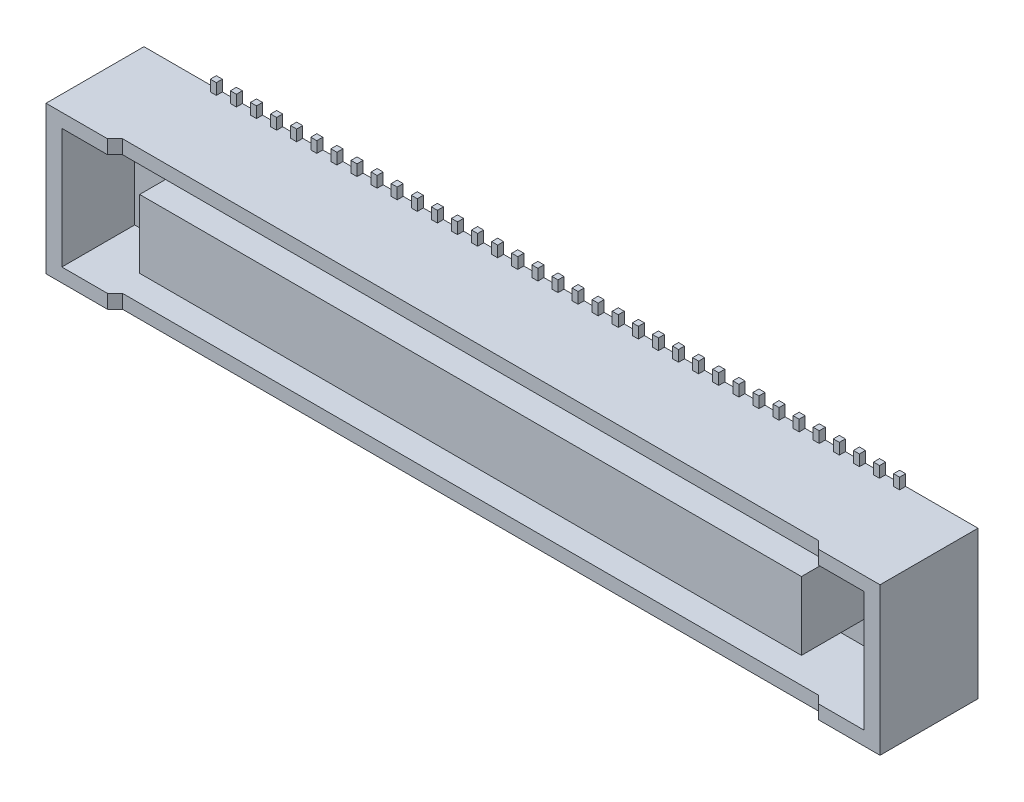
from build123d import *

# Parameters (mm, degrees)
BOSS_EXTRUDE1_DEPTH      = 1.47
CUT_EXTRUDE1_DEPTH       = 9.619216902
CUT_EXTRUDE1_DEPTH_BACK  = 1.3
SKETCH2_W                = 15.968931966
SKETCH2_H                = 2.390499192
SKETCH2_W_2              = 13.172045166
SKETCH2_H_2              = 1.359871744
SKETCH3_W                = 0.12
SKETCH3_H                = 0.12
BOSS_EXTRUDE2_DEPTH      = 0.22
LPATTERN1_COUNT          = 35
LPATTERN1_PITCH          = 0.4
MIRROR2_COPY_1_SKETCH_W  = 0.12
MIRROR2_COPY_1_SKETCH_H  = 0.12
MIRROR2_COPY_1_DEPTH     = 0.22
MIRROR2_COPY_2_SKETCH_W  = 0.12
MIRROR2_COPY_2_SKETCH_H  = 0.12
MIRROR2_COPY_2_DEPTH     = 0.22
MIRROR2_COPY_3_SKETCH_W  = 0.12
MIRROR2_COPY_3_SKETCH_H  = 0.12
MIRROR2_COPY_3_DEPTH     = 0.22
MIRROR2_COPY_4_SKETCH_W  = 0.12
MIRROR2_COPY_4_SKETCH_H  = 0.12
MIRROR2_COPY_4_DEPTH     = 0.22
MIRROR2_COPY_5_SKETCH_W  = 0.12
MIRROR2_COPY_5_SKETCH_H  = 0.12
MIRROR2_COPY_5_DEPTH     = 0.22
MIRROR2_COPY_6_SKETCH_W  = 0.12
MIRROR2_COPY_6_SKETCH_H  = 0.12
MIRROR2_COPY_6_DEPTH     = 0.22
MIRROR2_COPY_7_SKETCH_W  = 0.12
MIRROR2_COPY_7_SKETCH_H  = 0.12
MIRROR2_COPY_7_DEPTH     = 0.22
MIRROR2_COPY_8_SKETCH_W  = 0.12
MIRROR2_COPY_8_SKETCH_H  = 0.12
MIRROR2_COPY_8_DEPTH     = 0.22
MIRROR2_COPY_9_SKETCH_W  = 0.12
MIRROR2_COPY_9_SKETCH_H  = 0.12
MIRROR2_COPY_9_DEPTH     = 0.22
MIRROR2_COPY_10_SKETCH_W = 0.12
MIRROR2_COPY_10_SKETCH_H = 0.12
MIRROR2_COPY_10_DEPTH    = 0.22
MIRROR2_COPY_11_SKETCH_W = 0.12
MIRROR2_COPY_11_SKETCH_H = 0.12
MIRROR2_COPY_11_DEPTH    = 0.22
MIRROR2_COPY_12_SKETCH_W = 0.12
MIRROR2_COPY_12_SKETCH_H = 0.12
MIRROR2_COPY_12_DEPTH    = 0.22
MIRROR2_COPY_13_SKETCH_W = 0.12
MIRROR2_COPY_13_SKETCH_H = 0.12
MIRROR2_COPY_13_DEPTH    = 0.22
MIRROR2_COPY_14_SKETCH_W = 0.12
MIRROR2_COPY_14_SKETCH_H = 0.12
MIRROR2_COPY_14_DEPTH    = 0.22
MIRROR2_COPY_15_SKETCH_W = 0.12
MIRROR2_COPY_15_SKETCH_H = 0.12
MIRROR2_COPY_15_DEPTH    = 0.22
MIRROR2_COPY_16_SKETCH_W = 0.12
MIRROR2_COPY_16_SKETCH_H = 0.12
MIRROR2_COPY_16_DEPTH    = 0.22
MIRROR2_COPY_17_SKETCH_W = 0.12
MIRROR2_COPY_17_SKETCH_H = 0.12
MIRROR2_COPY_17_DEPTH    = 0.22
MIRROR2_COPY_18_SKETCH_W = 0.12
MIRROR2_COPY_18_SKETCH_H = 0.12
MIRROR2_COPY_18_DEPTH    = 0.22
MIRROR2_COPY_19_SKETCH_W = 0.12
MIRROR2_COPY_19_SKETCH_H = 0.12
MIRROR2_COPY_19_DEPTH    = 0.22
MIRROR2_COPY_20_SKETCH_W = 0.12
MIRROR2_COPY_20_SKETCH_H = 0.12
MIRROR2_COPY_20_DEPTH    = 0.22
MIRROR2_COPY_21_SKETCH_W = 0.12
MIRROR2_COPY_21_SKETCH_H = 0.12
MIRROR2_COPY_21_DEPTH    = 0.22
MIRROR2_COPY_22_SKETCH_W = 0.12
MIRROR2_COPY_22_SKETCH_H = 0.12
MIRROR2_COPY_22_DEPTH    = 0.22
MIRROR2_COPY_23_SKETCH_W = 0.12
MIRROR2_COPY_23_SKETCH_H = 0.12
MIRROR2_COPY_23_DEPTH    = 0.22
MIRROR2_COPY_24_SKETCH_W = 0.12
MIRROR2_COPY_24_SKETCH_H = 0.12
MIRROR2_COPY_24_DEPTH    = 0.22
MIRROR2_COPY_25_SKETCH_W = 0.12
MIRROR2_COPY_25_SKETCH_H = 0.12
MIRROR2_COPY_25_DEPTH    = 0.22
MIRROR2_COPY_26_SKETCH_W = 0.12
MIRROR2_COPY_26_SKETCH_H = 0.12
MIRROR2_COPY_26_DEPTH    = 0.22
MIRROR2_COPY_27_SKETCH_W = 0.12
MIRROR2_COPY_27_SKETCH_H = 0.12
MIRROR2_COPY_27_DEPTH    = 0.22
MIRROR2_COPY_28_SKETCH_W = 0.12
MIRROR2_COPY_28_SKETCH_H = 0.12
MIRROR2_COPY_28_DEPTH    = 0.22
MIRROR2_COPY_29_SKETCH_W = 0.12
MIRROR2_COPY_29_SKETCH_H = 0.12
MIRROR2_COPY_29_DEPTH    = 0.22
MIRROR2_COPY_30_SKETCH_W = 0.12
MIRROR2_COPY_30_SKETCH_H = 0.12
MIRROR2_COPY_30_DEPTH    = 0.22
MIRROR2_COPY_31_SKETCH_W = 0.12
MIRROR2_COPY_31_SKETCH_H = 0.12
MIRROR2_COPY_31_DEPTH    = 0.22
MIRROR2_COPY_32_SKETCH_W = 0.12
MIRROR2_COPY_32_SKETCH_H = 0.12
MIRROR2_COPY_32_DEPTH    = 0.22
MIRROR2_COPY_33_SKETCH_W = 0.12
MIRROR2_COPY_33_SKETCH_H = 0.12
MIRROR2_COPY_33_DEPTH    = 0.22
MIRROR2_COPY_34_SKETCH_W = 0.12
MIRROR2_COPY_34_SKETCH_H = 0.12
MIRROR2_COPY_34_DEPTH    = 0.22
MIRROR2_COPY_35_SKETCH_W = 0.12
MIRROR2_COPY_35_SKETCH_H = 0.12
MIRROR2_COPY_35_DEPTH    = 0.22


with BuildPart() as part:
    # Sketch1 → Boss-Extrude1 (new, symmetric)
    with BuildSketch(Plane(origin=(0, 0, 0), x_dir=(1, 0, 0), z_dir=(0, 1, 0))):
        Polygon((0, 0), (-8.3, 0), (-8.3, -1.95), (-7.076775671, -1.95), (-6.926775671, -1.8), (0, -1.8), align=None)
    boss_extrude1 = extrude(amount=BOSS_EXTRUDE1_DEPTH, both=True)

    # Mirror1: Boss-Extrude1 across plane
    add(boss_extrude1.mirror(Plane(origin=(0, 0, 0), x_dir=(0, 0, 1), z_dir=(1, 0, 0))))

    # Sketch2 → Cut-Extrude1 (cut, two sides: drawn at the far end of the back side and taken through both)
    with BuildSketch(Plane.XY.offset(1.8).offset(-CUT_EXTRUDE1_DEPTH_BACK)):
        Rectangle(SKETCH2_W, SKETCH2_H)
        Rectangle(SKETCH2_W_2, SKETCH2_H_2, mode=Mode.SUBTRACT)
    extrude(amount=CUT_EXTRUDE1_DEPTH + CUT_EXTRUDE1_DEPTH_BACK, mode=Mode.SUBTRACT)

    # Sketch3 → Boss-Extrude2 (add)
    with BuildSketch(Plane(origin=(0, -1.47, 0), x_dir=(-1, 0, 0), z_dir=(0, -1, 0))):
        with Locations((6.8, -0.06)):
            Rectangle(SKETCH3_W, SKETCH3_H)
    boss_extrude2 = extrude(amount=BOSS_EXTRUDE2_DEPTH)

    # LPattern1: Boss-Extrude2 ×35
    with Locations(*[(i * LPATTERN1_PITCH, 0, 0) for i in range(1, LPATTERN1_COUNT)]):
        add(boss_extrude2)

    # Mirror2 copy 1 sketch → Mirror2 copy 1 (add)
    with BuildSketch(Plane(origin=(0.4, 1.47, 0), x_dir=(-1, 0, 0), z_dir=(0, 1, 0))):
        with Locations((6.8, 0.06)):
            Rectangle(MIRROR2_COPY_1_SKETCH_W, MIRROR2_COPY_1_SKETCH_H)
    extrude(amount=MIRROR2_COPY_1_DEPTH)

    # Mirror2 copy 2 sketch → Mirror2 copy 2 (add)
    with BuildSketch(Plane(origin=(0.8, 1.47, 0), x_dir=(-1, 0, 0), z_dir=(0, 1, 0))):
        with Locations((6.8, 0.06)):
            Rectangle(MIRROR2_COPY_2_SKETCH_W, MIRROR2_COPY_2_SKETCH_H)
    extrude(amount=MIRROR2_COPY_2_DEPTH)

    # Mirror2 copy 3 sketch → Mirror2 copy 3 (add)
    with BuildSketch(Plane(origin=(1.2, 1.47, 0), x_dir=(-1, 0, 0), z_dir=(0, 1, 0))):
        with Locations((6.8, 0.06)):
            Rectangle(MIRROR2_COPY_3_SKETCH_W, MIRROR2_COPY_3_SKETCH_H)
    extrude(amount=MIRROR2_COPY_3_DEPTH)

    # Mirror2 copy 4 sketch → Mirror2 copy 4 (add)
    with BuildSketch(Plane(origin=(1.6, 1.47, 0), x_dir=(-1, 0, 0), z_dir=(0, 1, 0))):
        with Locations((6.8, 0.06)):
            Rectangle(MIRROR2_COPY_4_SKETCH_W, MIRROR2_COPY_4_SKETCH_H)
    extrude(amount=MIRROR2_COPY_4_DEPTH)

    # Mirror2 copy 5 sketch → Mirror2 copy 5 (add)
    with BuildSketch(Plane(origin=(2, 1.47, 0), x_dir=(-1, 0, 0), z_dir=(0, 1, 0))):
        with Locations((6.8, 0.06)):
            Rectangle(MIRROR2_COPY_5_SKETCH_W, MIRROR2_COPY_5_SKETCH_H)
    extrude(amount=MIRROR2_COPY_5_DEPTH)

    # Mirror2 copy 6 sketch → Mirror2 copy 6 (add)
    with BuildSketch(Plane(origin=(2.4, 1.47, 0), x_dir=(-1, 0, 0), z_dir=(0, 1, 0))):
        with Locations((6.8, 0.06)):
            Rectangle(MIRROR2_COPY_6_SKETCH_W, MIRROR2_COPY_6_SKETCH_H)
    extrude(amount=MIRROR2_COPY_6_DEPTH)

    # Mirror2 copy 7 sketch → Mirror2 copy 7 (add)
    with BuildSketch(Plane(origin=(2.8, 1.47, 0), x_dir=(-1, 0, 0), z_dir=(0, 1, 0))):
        with Locations((6.8, 0.06)):
            Rectangle(MIRROR2_COPY_7_SKETCH_W, MIRROR2_COPY_7_SKETCH_H)
    extrude(amount=MIRROR2_COPY_7_DEPTH)

    # Mirror2 copy 8 sketch → Mirror2 copy 8 (add)
    with BuildSketch(Plane(origin=(3.2, 1.47, 0), x_dir=(-1, 0, 0), z_dir=(0, 1, 0))):
        with Locations((6.8, 0.06)):
            Rectangle(MIRROR2_COPY_8_SKETCH_W, MIRROR2_COPY_8_SKETCH_H)
    extrude(amount=MIRROR2_COPY_8_DEPTH)

    # Mirror2 copy 9 sketch → Mirror2 copy 9 (add)
    with BuildSketch(Plane(origin=(3.6, 1.47, 0), x_dir=(-1, 0, 0), z_dir=(0, 1, 0))):
        with Locations((6.8, 0.06)):
            Rectangle(MIRROR2_COPY_9_SKETCH_W, MIRROR2_COPY_9_SKETCH_H)
    extrude(amount=MIRROR2_COPY_9_DEPTH)

    # Mirror2 copy 10 sketch → Mirror2 copy 10 (add)
    with BuildSketch(Plane(origin=(4, 1.47, 0), x_dir=(-1, 0, 0), z_dir=(0, 1, 0))):
        with Locations((6.8, 0.06)):
            Rectangle(MIRROR2_COPY_10_SKETCH_W, MIRROR2_COPY_10_SKETCH_H)
    extrude(amount=MIRROR2_COPY_10_DEPTH)

    # Mirror2 copy 11 sketch → Mirror2 copy 11 (add)
    with BuildSketch(Plane(origin=(4.4, 1.47, 0), x_dir=(-1, 0, 0), z_dir=(0, 1, 0))):
        with Locations((6.8, 0.06)):
            Rectangle(MIRROR2_COPY_11_SKETCH_W, MIRROR2_COPY_11_SKETCH_H)
    extrude(amount=MIRROR2_COPY_11_DEPTH)

    # Mirror2 copy 12 sketch → Mirror2 copy 12 (add)
    with BuildSketch(Plane(origin=(4.8, 1.47, 0), x_dir=(-1, 0, 0), z_dir=(0, 1, 0))):
        with Locations((6.8, 0.06)):
            Rectangle(MIRROR2_COPY_12_SKETCH_W, MIRROR2_COPY_12_SKETCH_H)
    extrude(amount=MIRROR2_COPY_12_DEPTH)

    # Mirror2 copy 13 sketch → Mirror2 copy 13 (add)
    with BuildSketch(Plane(origin=(5.2, 1.47, 0), x_dir=(-1, 0, 0), z_dir=(0, 1, 0))):
        with Locations((6.8, 0.06)):
            Rectangle(MIRROR2_COPY_13_SKETCH_W, MIRROR2_COPY_13_SKETCH_H)
    extrude(amount=MIRROR2_COPY_13_DEPTH)

    # Mirror2 copy 14 sketch → Mirror2 copy 14 (add)
    with BuildSketch(Plane(origin=(5.6, 1.47, 0), x_dir=(-1, 0, 0), z_dir=(0, 1, 0))):
        with Locations((6.8, 0.06)):
            Rectangle(MIRROR2_COPY_14_SKETCH_W, MIRROR2_COPY_14_SKETCH_H)
    extrude(amount=MIRROR2_COPY_14_DEPTH)

    # Mirror2 copy 15 sketch → Mirror2 copy 15 (add)
    with BuildSketch(Plane(origin=(6, 1.47, 0), x_dir=(-1, 0, 0), z_dir=(0, 1, 0))):
        with Locations((6.8, 0.06)):
            Rectangle(MIRROR2_COPY_15_SKETCH_W, MIRROR2_COPY_15_SKETCH_H)
    extrude(amount=MIRROR2_COPY_15_DEPTH)

    # Mirror2 copy 16 sketch → Mirror2 copy 16 (add)
    with BuildSketch(Plane(origin=(6.4, 1.47, 0), x_dir=(-1, 0, 0), z_dir=(0, 1, 0))):
        with Locations((6.8, 0.06)):
            Rectangle(MIRROR2_COPY_16_SKETCH_W, MIRROR2_COPY_16_SKETCH_H)
    extrude(amount=MIRROR2_COPY_16_DEPTH)

    # Mirror2 copy 17 sketch → Mirror2 copy 17 (add)
    with BuildSketch(Plane(origin=(6.8, 1.47, 0), x_dir=(-1, 0, 0), z_dir=(0, 1, 0))):
        with Locations((6.8, 0.06)):
            Rectangle(MIRROR2_COPY_17_SKETCH_W, MIRROR2_COPY_17_SKETCH_H)
    extrude(amount=MIRROR2_COPY_17_DEPTH)

    # Mirror2 copy 18 sketch → Mirror2 copy 18 (add)
    with BuildSketch(Plane(origin=(7.2, 1.47, 0), x_dir=(-1, 0, 0), z_dir=(0, 1, 0))):
        with Locations((6.8, 0.06)):
            Rectangle(MIRROR2_COPY_18_SKETCH_W, MIRROR2_COPY_18_SKETCH_H)
    extrude(amount=MIRROR2_COPY_18_DEPTH)

    # Mirror2 copy 19 sketch → Mirror2 copy 19 (add)
    with BuildSketch(Plane(origin=(7.6, 1.47, 0), x_dir=(-1, 0, 0), z_dir=(0, 1, 0))):
        with Locations((6.8, 0.06)):
            Rectangle(MIRROR2_COPY_19_SKETCH_W, MIRROR2_COPY_19_SKETCH_H)
    extrude(amount=MIRROR2_COPY_19_DEPTH)

    # Mirror2 copy 20 sketch → Mirror2 copy 20 (add)
    with BuildSketch(Plane(origin=(8, 1.47, 0), x_dir=(-1, 0, 0), z_dir=(0, 1, 0))):
        with Locations((6.8, 0.06)):
            Rectangle(MIRROR2_COPY_20_SKETCH_W, MIRROR2_COPY_20_SKETCH_H)
    extrude(amount=MIRROR2_COPY_20_DEPTH)

    # Mirror2 copy 21 sketch → Mirror2 copy 21 (add)
    with BuildSketch(Plane(origin=(8.4, 1.47, 0), x_dir=(-1, 0, 0), z_dir=(0, 1, 0))):
        with Locations((6.8, 0.06)):
            Rectangle(MIRROR2_COPY_21_SKETCH_W, MIRROR2_COPY_21_SKETCH_H)
    extrude(amount=MIRROR2_COPY_21_DEPTH)

    # Mirror2 copy 22 sketch → Mirror2 copy 22 (add)
    with BuildSketch(Plane(origin=(8.8, 1.47, 0), x_dir=(-1, 0, 0), z_dir=(0, 1, 0))):
        with Locations((6.8, 0.06)):
            Rectangle(MIRROR2_COPY_22_SKETCH_W, MIRROR2_COPY_22_SKETCH_H)
    extrude(amount=MIRROR2_COPY_22_DEPTH)

    # Mirror2 copy 23 sketch → Mirror2 copy 23 (add)
    with BuildSketch(Plane(origin=(9.2, 1.47, 0), x_dir=(-1, 0, 0), z_dir=(0, 1, 0))):
        with Locations((6.8, 0.06)):
            Rectangle(MIRROR2_COPY_23_SKETCH_W, MIRROR2_COPY_23_SKETCH_H)
    extrude(amount=MIRROR2_COPY_23_DEPTH)

    # Mirror2 copy 24 sketch → Mirror2 copy 24 (add)
    with BuildSketch(Plane(origin=(9.6, 1.47, 0), x_dir=(-1, 0, 0), z_dir=(0, 1, 0))):
        with Locations((6.8, 0.06)):
            Rectangle(MIRROR2_COPY_24_SKETCH_W, MIRROR2_COPY_24_SKETCH_H)
    extrude(amount=MIRROR2_COPY_24_DEPTH)

    # Mirror2 copy 25 sketch → Mirror2 copy 25 (add)
    with BuildSketch(Plane(origin=(10, 1.47, 0), x_dir=(-1, 0, 0), z_dir=(0, 1, 0))):
        with Locations((6.8, 0.06)):
            Rectangle(MIRROR2_COPY_25_SKETCH_W, MIRROR2_COPY_25_SKETCH_H)
    extrude(amount=MIRROR2_COPY_25_DEPTH)

    # Mirror2 copy 26 sketch → Mirror2 copy 26 (add)
    with BuildSketch(Plane(origin=(10.4, 1.47, 0), x_dir=(-1, 0, 0), z_dir=(0, 1, 0))):
        with Locations((6.8, 0.06)):
            Rectangle(MIRROR2_COPY_26_SKETCH_W, MIRROR2_COPY_26_SKETCH_H)
    extrude(amount=MIRROR2_COPY_26_DEPTH)

    # Mirror2 copy 27 sketch → Mirror2 copy 27 (add)
    with BuildSketch(Plane(origin=(10.8, 1.47, 0), x_dir=(-1, 0, 0), z_dir=(0, 1, 0))):
        with Locations((6.8, 0.06)):
            Rectangle(MIRROR2_COPY_27_SKETCH_W, MIRROR2_COPY_27_SKETCH_H)
    extrude(amount=MIRROR2_COPY_27_DEPTH)

    # Mirror2 copy 28 sketch → Mirror2 copy 28 (add)
    with BuildSketch(Plane(origin=(11.2, 1.47, 0), x_dir=(-1, 0, 0), z_dir=(0, 1, 0))):
        with Locations((6.8, 0.06)):
            Rectangle(MIRROR2_COPY_28_SKETCH_W, MIRROR2_COPY_28_SKETCH_H)
    extrude(amount=MIRROR2_COPY_28_DEPTH)

    # Mirror2 copy 29 sketch → Mirror2 copy 29 (add)
    with BuildSketch(Plane(origin=(11.6, 1.47, 0), x_dir=(-1, 0, 0), z_dir=(0, 1, 0))):
        with Locations((6.8, 0.06)):
            Rectangle(MIRROR2_COPY_29_SKETCH_W, MIRROR2_COPY_29_SKETCH_H)
    extrude(amount=MIRROR2_COPY_29_DEPTH)

    # Mirror2 copy 30 sketch → Mirror2 copy 30 (add)
    with BuildSketch(Plane(origin=(12, 1.47, 0), x_dir=(-1, 0, 0), z_dir=(0, 1, 0))):
        with Locations((6.8, 0.06)):
            Rectangle(MIRROR2_COPY_30_SKETCH_W, MIRROR2_COPY_30_SKETCH_H)
    extrude(amount=MIRROR2_COPY_30_DEPTH)

    # Mirror2 copy 31 sketch → Mirror2 copy 31 (add)
    with BuildSketch(Plane(origin=(12.4, 1.47, 0), x_dir=(-1, 0, 0), z_dir=(0, 1, 0))):
        with Locations((6.8, 0.06)):
            Rectangle(MIRROR2_COPY_31_SKETCH_W, MIRROR2_COPY_31_SKETCH_H)
    extrude(amount=MIRROR2_COPY_31_DEPTH)

    # Mirror2 copy 32 sketch → Mirror2 copy 32 (add)
    with BuildSketch(Plane(origin=(12.8, 1.47, 0), x_dir=(-1, 0, 0), z_dir=(0, 1, 0))):
        with Locations((6.8, 0.06)):
            Rectangle(MIRROR2_COPY_32_SKETCH_W, MIRROR2_COPY_32_SKETCH_H)
    extrude(amount=MIRROR2_COPY_32_DEPTH)

    # Mirror2 copy 33 sketch → Mirror2 copy 33 (add)
    with BuildSketch(Plane(origin=(13.2, 1.47, 0), x_dir=(-1, 0, 0), z_dir=(0, 1, 0))):
        with Locations((6.8, 0.06)):
            Rectangle(MIRROR2_COPY_33_SKETCH_W, MIRROR2_COPY_33_SKETCH_H)
    extrude(amount=MIRROR2_COPY_33_DEPTH)

    # Mirror2 copy 34 sketch → Mirror2 copy 34 (add)
    with BuildSketch(Plane(origin=(13.6, 1.47, 0), x_dir=(-1, 0, 0), z_dir=(0, 1, 0))):
        with Locations((6.8, 0.06)):
            Rectangle(MIRROR2_COPY_34_SKETCH_W, MIRROR2_COPY_34_SKETCH_H)
    extrude(amount=MIRROR2_COPY_34_DEPTH)

    # Mirror2 copy 35 sketch → Mirror2 copy 35 (add)
    with BuildSketch(Plane(origin=(0, 1.47, 0), x_dir=(-1, 0, 0), z_dir=(0, 1, 0))):
        with Locations((6.8, 0.06)):
            Rectangle(MIRROR2_COPY_35_SKETCH_W, MIRROR2_COPY_35_SKETCH_H)
    extrude(amount=MIRROR2_COPY_35_DEPTH)


solid = part.part
